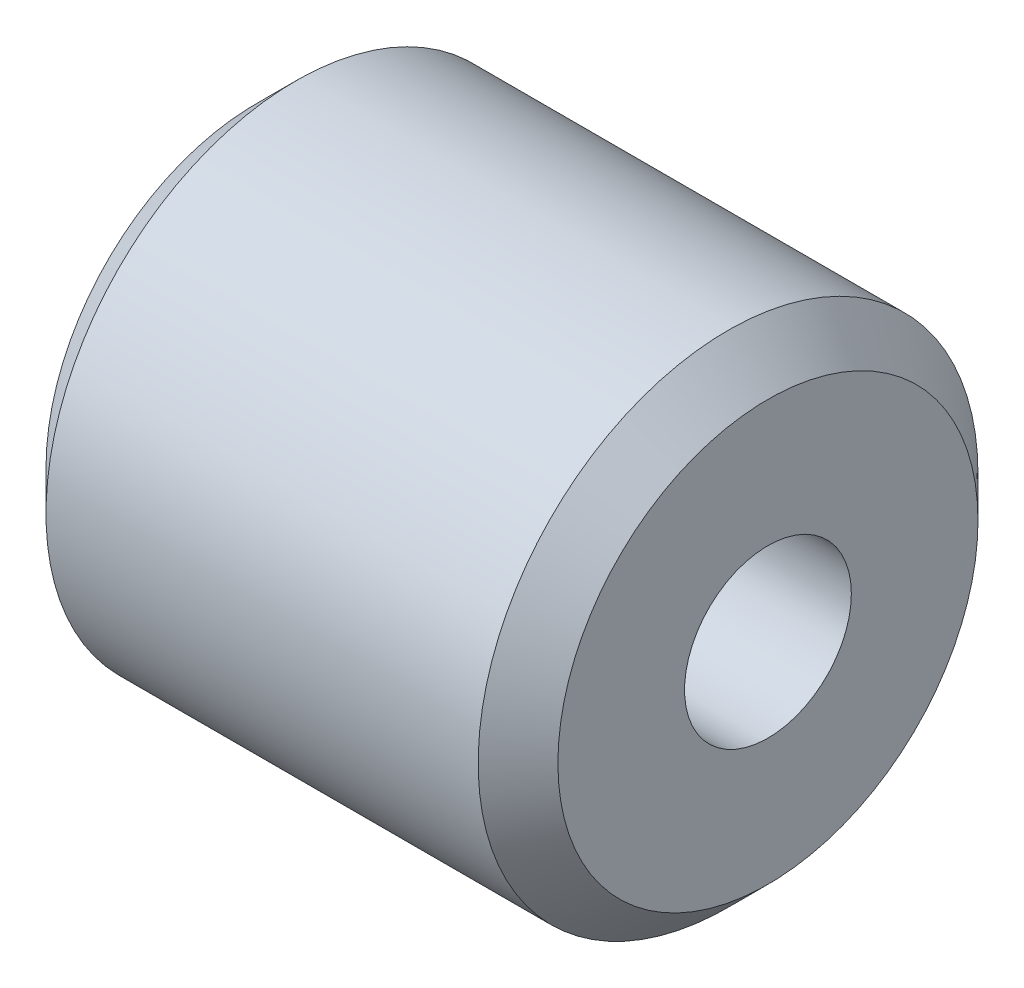
from build123d import *

# Parameters (mm, degrees)
SKETCH1_R           = 4.765
SKETCH1_R_2         = 1.59
BOSS_EXTRUDE1_DEPTH = 4.88
CHAMFER1_SIZE       = 0.76


with BuildPart() as part:
    # Sketch1 → Boss-Extrude1 (new, symmetric)
    with BuildSketch(Plane(origin=(0, 0, 0), x_dir=(0, 0, -1), z_dir=(1, 0, 0))):
        Circle(SKETCH1_R)
        Circle(SKETCH1_R_2, mode=Mode.SUBTRACT)
    extrude(amount=BOSS_EXTRUDE1_DEPTH, both=True)

    # Chamfer1
    chamfer1_edges = [part.edges().sort_by_distance(p)[0] for p in [
        (-4.88, 0, 4.765),
        (4.88, 0, 4.765),
    ]]
    chamfer(chamfer1_edges, length=CHAMFER1_SIZE)


solid = part.part
